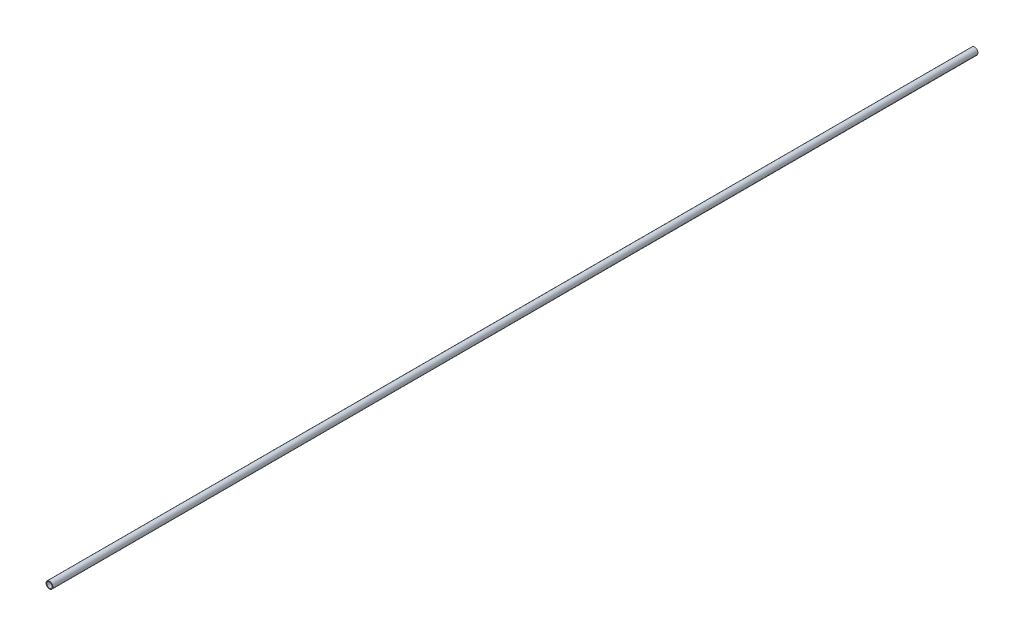
from build123d import *

# Parameters (mm, degrees)
SKETCH_1_R      = 5
SKETCH_1_R_2    = 4
EXTRUDE_1_DEPTH = 1350


with BuildPart() as part:
    # Эскиз1 → Бобышка-Вытянуть1 (new body)
    with BuildSketch(Plane.XY):
        Circle(SKETCH_1_R)
        Circle(SKETCH_1_R_2, mode=Mode.SUBTRACT)
    extrude(amount=EXTRUDE_1_DEPTH)


solid = part.part
